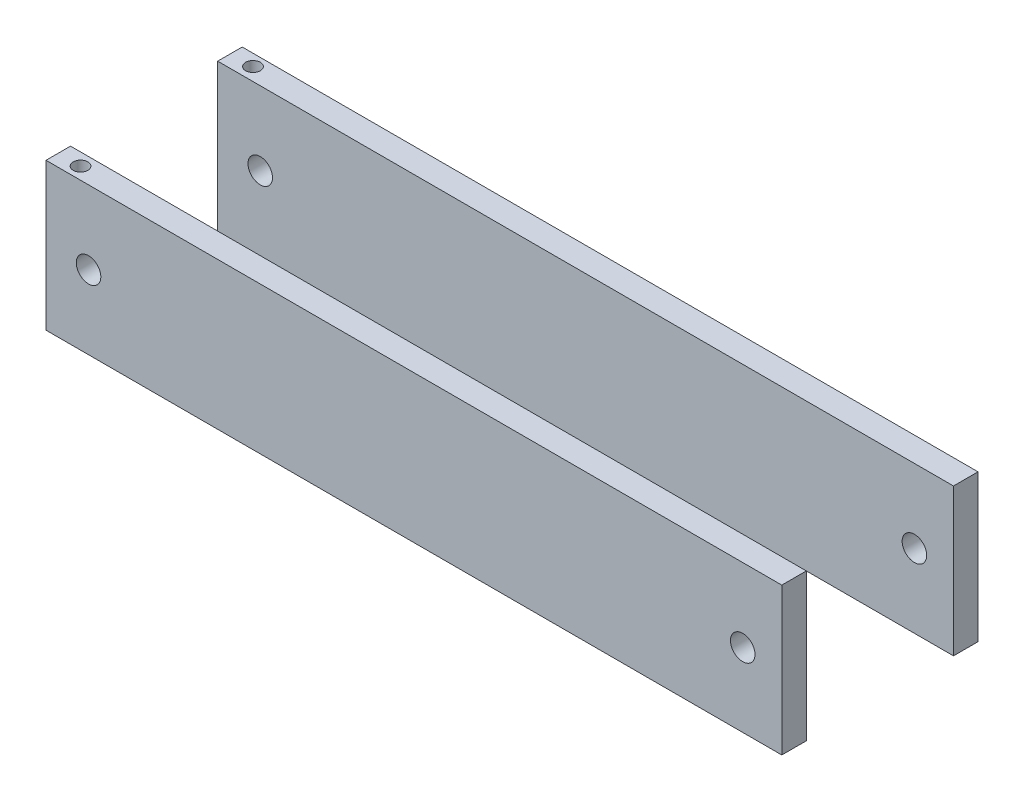
from build123d import *

# Parameters (mm, degrees)
SKETCH1_W           = 300
SKETCH1_H           = 60
BOSS_EXTRUDE1_DEPTH = 40
SKETCH2_W           = 300
SKETCH2_H           = 60
CUT_EXTRUDE2_DEPTH  = 167.433169771
SKETCH5_R           = 5
CUT_EXTRUDE3_DEPTH  = 173.626765016
SKETCH7_R           = 3
CUT_EXTRUDE4_DEPTH  = 10


with BuildPart() as part:
    # Sketch1 → Boss-Extrude1 (new, symmetric)
    with BuildSketch(Plane.XY):
        Rectangle(SKETCH1_W, SKETCH1_H)
    extrude(amount=BOSS_EXTRUDE1_DEPTH, both=True)

    # Sketch2 → Cut-Extrude2 (cut, through all)
    with BuildSketch(Plane(origin=(0, 30, 0), x_dir=(1, 0, 0), z_dir=(0, 1, 0))):
        Rectangle(SKETCH2_W, SKETCH2_H)
    extrude(amount=-CUT_EXTRUDE2_DEPTH, mode=Mode.SUBTRACT)


with BuildPart() as cut_extrude2_piece_1:
    # of the separate pieces the step leaves, piece 1, a body of its own (cut_extrude2_pieces)
    add(part.part.solids().sort_by_distance((-150, 30, -40))[0])


with BuildPart() as cut_extrude2_piece_2:
    # of the separate pieces the step leaves, piece 2, a body of its own (cut_extrude2_pieces)
    add(part.part.solids().sort_by_distance((-150, 30, 30))[0])


with BuildPart() as cut_extrude3_tool:
    # Sketch5 → Cut-Extrude3 (new, through all)
    with BuildSketch(Plane(origin=(0, 0, -40), x_dir=(-1, 0, 0), z_dir=(0, 0, -1))):
        with Locations((-134.072867863, 0)):
            Circle(SKETCH5_R)
        with Locations((132.649589011, 0)):
            Circle(SKETCH5_R)
    extrude(amount=-CUT_EXTRUDE3_DEPTH)


with BuildPart() as cut_extrude2_piece_1_1:
    add(cut_extrude2_piece_1.part)

    # Cut-Extrude3: cut by cut_extrude3_tool
    add(cut_extrude3_tool.part, mode=Mode.SUBTRACT)


with BuildPart() as cut_extrude2_piece_2_1:
    add(cut_extrude2_piece_2.part)

    # Cut-Extrude3: cut by cut_extrude3_tool
    add(cut_extrude3_tool.part, mode=Mode.SUBTRACT)


with BuildPart() as cut_extrude4_tool:
    # Sketch7 → Cut-Extrude4 (new body)
    with BuildSketch(Plane(origin=(0, 30, 0), x_dir=(1, 0, 0), z_dir=(0, 1, 0))):
        with Locations(Location((-140.904606353, -35.01265976, 0), (0, 0, 270))):
            Circle(SKETCH7_R)
        with Locations(Location((-140.904606353, 35.297315531, 0), (0, 0, 270))):
            Circle(SKETCH7_R)
    extrude(amount=-CUT_EXTRUDE4_DEPTH)


with BuildPart() as cut_extrude2_piece_1_2:
    add(cut_extrude2_piece_1_1.part)

    # Cut-Extrude4: cut by cut_extrude4_tool
    add(cut_extrude4_tool.part, mode=Mode.SUBTRACT)


with BuildPart() as cut_extrude2_piece_2_2:
    add(cut_extrude2_piece_2_1.part)

    # Cut-Extrude4: cut by cut_extrude4_tool
    add(cut_extrude4_tool.part, mode=Mode.SUBTRACT)


solid = Compound([cut_extrude2_piece_1_2.part, cut_extrude2_piece_2_2.part])
